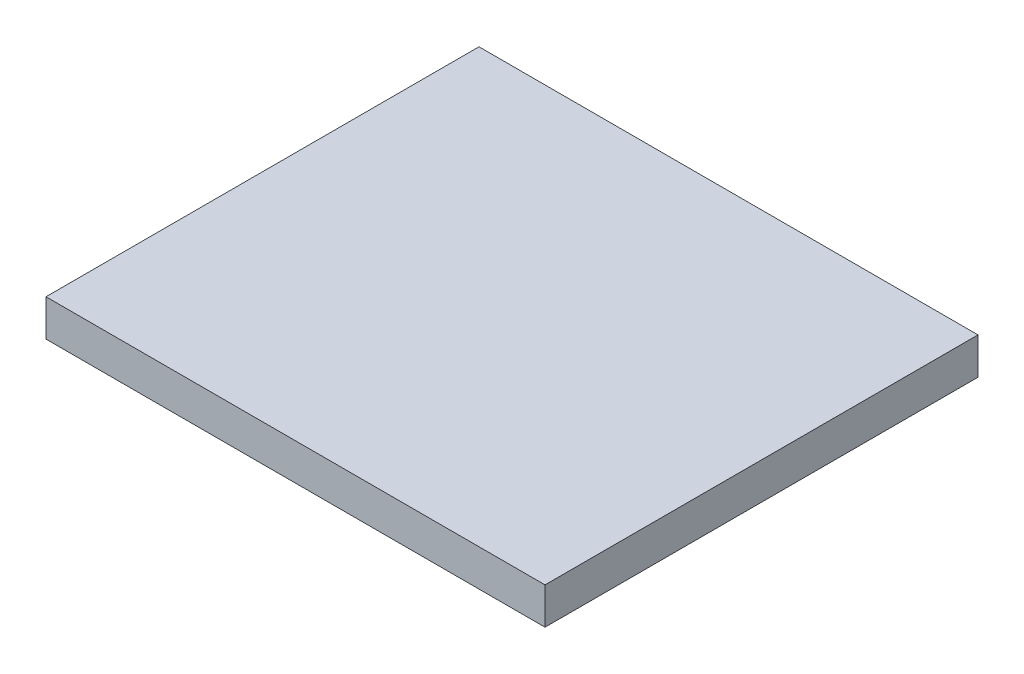
from build123d import *

# Parameters (mm, degrees)
SKETCH1_W           = 68
SKETCH1_H           = 59
BOSS_EXTRUDE1_DEPTH = 5


with BuildPart() as part:
    # Sketch1 → Boss-Extrude1 (new body)
    with BuildSketch(Plane(origin=(0, 0, 0), x_dir=(1, 0, 0), z_dir=(0, 1, 0))):
        Rectangle(SKETCH1_W, SKETCH1_H)
    extrude(amount=BOSS_EXTRUDE1_DEPTH)


solid = part.part
